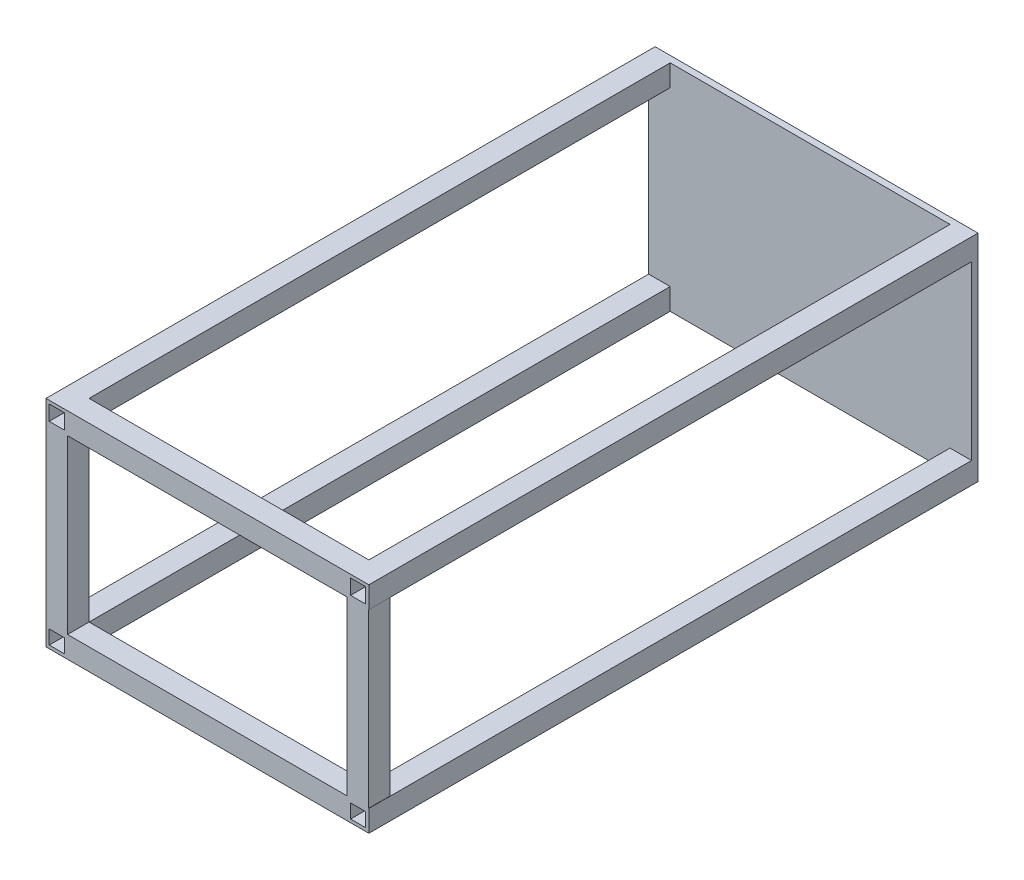
from build123d import *

# Parameters (mm, degrees)
SKETCH1_W           = 150
SKETCH1_H           = 100
BOSS_EXTRUDE1_DEPTH = 3
SKETCH2_W           = 10
SKETCH2_H           = 10
SKETCH2_W_2         = 7
SKETCH2_H_2         = 7
BOSS_EXTRUDE2_DEPTH = 280
SKETCH3_W           = 10
SKETCH3_H           = 10
SKETCH3_W_2         = 7
SKETCH3_H_2         = 7
BOSS_EXTRUDE3_DEPTH = 130
SKETCH4_W           = 10
SKETCH4_H           = 10
SKETCH4_W_2         = 7
SKETCH4_H_2         = 7
BOSS_EXTRUDE4_DEPTH = 130
SKETCH5_W           = 10
SKETCH5_H           = 10
SKETCH5_W_2         = 7
SKETCH5_H_2         = 7
BOSS_EXTRUDE5_DEPTH = 82


with BuildPart() as part:
    # Sketch1 → Boss-Extrude1 (new body)
    with BuildSketch(Plane.XY):
        with Locations((75, 50)):
            Rectangle(SKETCH1_W, SKETCH1_H)
    extrude(amount=BOSS_EXTRUDE1_DEPTH)

    # Sketch2 → Boss-Extrude2 (add)
    # profile 1 of 4: a face of its own
    with BuildSketch(Plane.XY.offset(3)):
        with Locations((145, 95)):
            Rectangle(SKETCH2_W, SKETCH2_H)
        with Locations((145, 95)):
            Rectangle(SKETCH2_W_2, SKETCH2_H_2, mode=Mode.SUBTRACT)
    # profile 2 of 4: a face of its own
    with BuildSketch(Plane.XY.offset(3)):
        with Locations((145, 5)):
            Rectangle(SKETCH2_W, SKETCH2_H)
        with Locations((145, 5)):
            Rectangle(SKETCH2_W_2, SKETCH2_H_2, mode=Mode.SUBTRACT)
    # profile 3 of 4: a face of its own
    with BuildSketch(Plane.XY.offset(3)):
        with Locations((5, 5)):
            Rectangle(SKETCH2_W, SKETCH2_H)
        with Locations((5, 5)):
            Rectangle(SKETCH2_W_2, SKETCH2_H_2, mode=Mode.SUBTRACT)
    # profile 4 of 4: a face of its own
    with BuildSketch(Plane.XY.offset(3)):
        with Locations((5, 95)):
            Rectangle(SKETCH2_W, SKETCH2_H)
        with Locations((5, 95)):
            Rectangle(SKETCH2_W_2, SKETCH2_H_2, mode=Mode.SUBTRACT)
    extrude(amount=BOSS_EXTRUDE2_DEPTH)

    # Sketch3 → Boss-Extrude3 (add)
    with BuildSketch(Plane.ZY.offset(-140)):
        with Locations((278, 95)):
            Rectangle(SKETCH3_W, SKETCH3_H)
        with Locations((278, 95)):
            Rectangle(SKETCH3_W_2, SKETCH3_H_2, mode=Mode.SUBTRACT)
    extrude(amount=BOSS_EXTRUDE3_DEPTH)

    # Sketch4 → Boss-Extrude4 (add)
    with BuildSketch(Plane.ZY.offset(-140)):
        with Locations((278, 5)):
            Rectangle(SKETCH4_W, SKETCH4_H)
        with Locations((278, 5)):
            Rectangle(SKETCH4_W_2, SKETCH4_H_2, mode=Mode.SUBTRACT)
    extrude(amount=BOSS_EXTRUDE4_DEPTH)

    # Sketch5 → Boss-Extrude5 (add)
    # profile 1 of 2: a face of its own
    with BuildSketch(Plane.XZ.offset(-90)):
        with Locations((5, 278)):
            Rectangle(SKETCH5_W, SKETCH5_H)
        with Locations((5, 278)):
            Rectangle(SKETCH5_W_2, SKETCH5_H_2, mode=Mode.SUBTRACT)
    # profile 2 of 2: a face of its own
    with BuildSketch(Plane.XZ.offset(-90)):
        with Locations((144.9, 278)):
            Rectangle(SKETCH5_W, SKETCH5_H)
        with Locations((144.9, 278)):
            Rectangle(SKETCH5_W_2, SKETCH5_H_2, mode=Mode.SUBTRACT)
    extrude(amount=BOSS_EXTRUDE5_DEPTH)


solid = part.part
